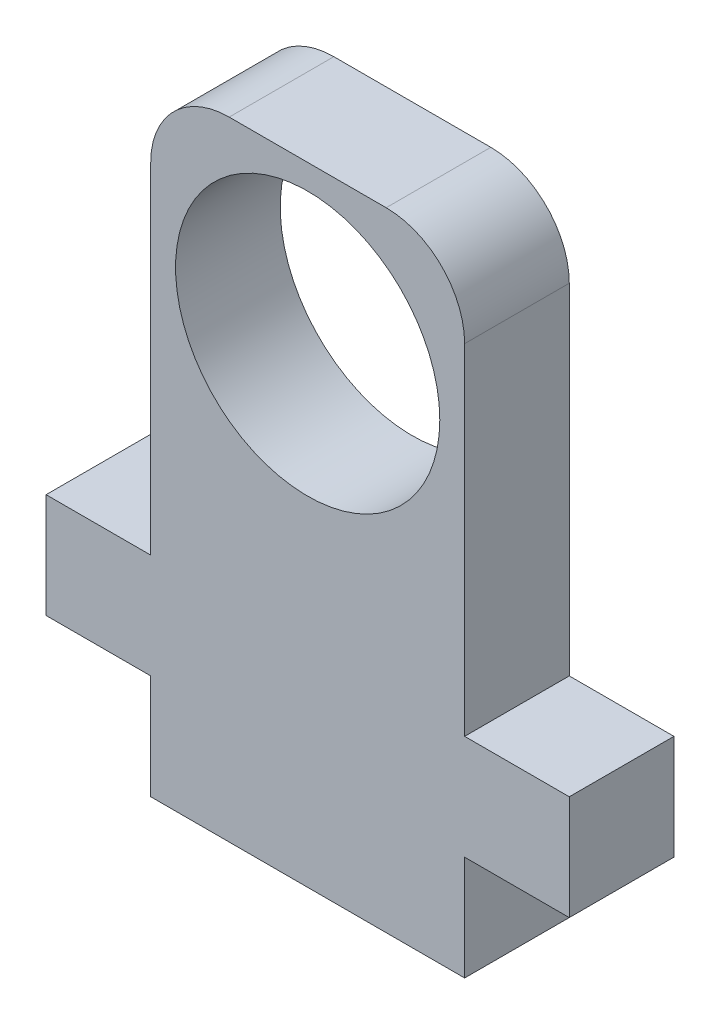
from build123d import *

# Parameters (mm, degrees)
SKETCH_1_R      = 5.05
EXTRUDE_1_DEPTH = 4


with BuildPart() as part:
    # Эскиз1 → Бобышка-Вытянуть1 (new body)
    with BuildSketch(Plane.XY):
        with BuildLine():
            Line((0, 0), (0, 4))
            Line((0, 4), (4, 4))
            Line((4, 4), (4, 8))
            Line((4, 8), (4, 17))
            ThreePointArc((4, 17), (4.878679656, 19.121320344), (7, 20))
            Line((7, 20), (13, 20))
            ThreePointArc((13, 20), (15.121320344, 19.121320344), (16, 17))
            Line((16, 17), (16, 8))
            Line((16, 8), (16, 4))
            Line((16, 4), (20, 4))
            Line((20, 4), (20, 0))
            Line((20, 0), (16, 0))
            Line((16, 0), (16, -4))
            Line((16, -4), (4, -4))
            Line((4, -4), (4, 0))
            Line((4, 0), (0, 0))
        make_face()
        with Locations((10, 14)):
            Circle(SKETCH_1_R, mode=Mode.SUBTRACT)
    extrude(amount=EXTRUDE_1_DEPTH)


solid = part.part
